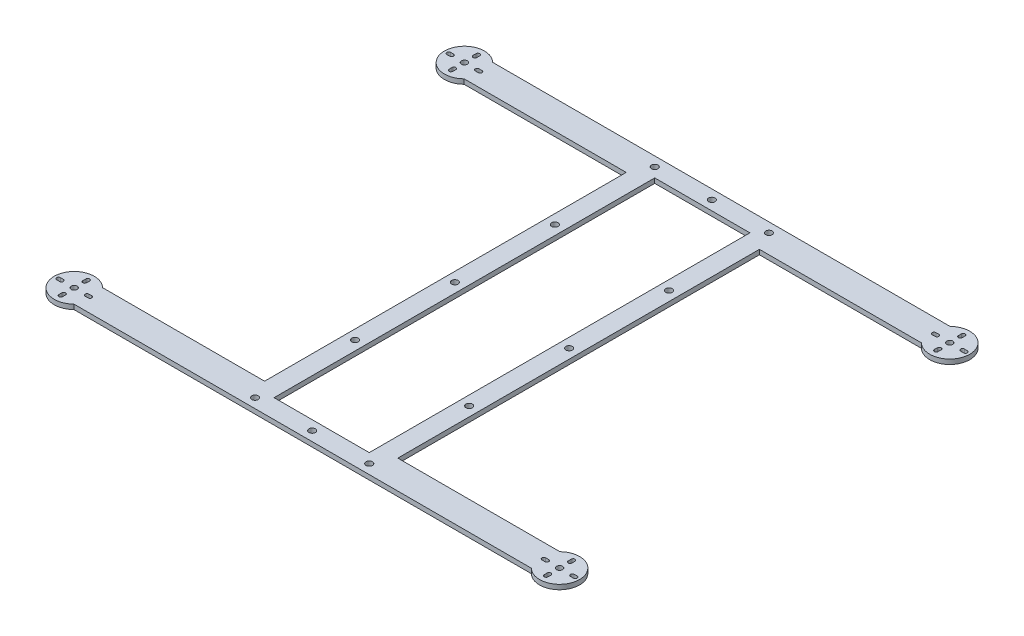
from build123d import *

# Parameters (mm, degrees)
SKETCH1_W           = 63.5
SKETCH1_H           = 254
BOSS_EXTRUDE1_DEPTH = 3.175
SKETCH4_R           = 13.335
BOSS_EXTRUDE4_DEPTH = 3.175
SKETCH5_R           = 2
MOTOR_HOLES_DEPTH   = 227.541979167
SKETCH7_R           = 2.159
CUT_EXTRUDE2_DEPTH  = 227.541979167


with BuildPart() as part:
    # Sketch1 → Boss-Extrude1 (new body)
    with BuildSketch(Plane(origin=(0, 0, 0), x_dir=(1, 0, 0), z_dir=(0, 1, 0))):
        Polygon((-44.45, 139.7), (44.45, 139.7), (161.925, 139.7), (161.925, 120.65), (44.45, 120.65), (44.45, -120.65), (161.925, -120.65), (161.925, -139.7), (44.45, -139.7), (-44.45, -139.7), (-161.925, -139.7), (-161.925, -120.65), (-44.45, -120.65), (-44.45, 120.65), (-161.925, 120.65), (-161.925, 139.7), align=None)
        Rectangle(SKETCH1_W, SKETCH1_H, mode=Mode.SUBTRACT)
    extrude(amount=BOSS_EXTRUDE1_DEPTH)

    # Sketch4 → Boss-Extrude4 (add)
    with BuildSketch(Plane(origin=(0, 3.175, 0), x_dir=(1, 0, 0), z_dir=(0, 1, 0))):
        with Locations((161.925, 130.175)):
            Circle(SKETCH4_R)
        with Locations((-161.925, 130.175)):
            Circle(SKETCH4_R)
        with Locations((-161.925, -130.175)):
            Circle(SKETCH4_R)
        with Locations((161.925, -130.175)):
            Circle(SKETCH4_R)
    extrude(amount=-BOSS_EXTRUDE4_DEPTH)

    # Sketch5 → Motor Holes (cut, through all)
    with BuildSketch(Plane(origin=(0, 3.175, 0), x_dir=(1, 0, 0), z_dir=(0, 1, 0))):
        with Locations(Location((161.925, 130.175, 0), (0, 0, 270))):
            Circle(SKETCH5_R)
        with Locations(Location((-161.925, 130.175, 0), (0, 0, 90))):
            Circle(SKETCH5_R)
        with Locations(Location((161.925, -130.175, 0), (0, 0, 90))):
            Circle(SKETCH5_R)
        with Locations(Location((-161.925, -130.175, 0), (0, 0, 270))):
            Circle(SKETCH5_R)
        with BuildLine():
            Line((151.425, 131.425), (153.425, 131.425))
            ThreePointArc((153.425, 131.425), (154.675, 130.175), (153.425, 128.925))
            Line((153.425, 128.925), (151.425, 128.925))
            ThreePointArc((151.425, 128.925), (150.175, 130.175), (151.425, 131.425))
        make_face()
        with BuildLine():
            Line((172.425, 131.425), (170.425, 131.425))
            ThreePointArc((170.425, 131.425), (169.175, 130.175), (170.425, 128.925))
            Line((170.425, 128.925), (172.425, 128.925))
            ThreePointArc((172.425, 128.925), (173.675, 130.175), (172.425, 131.425))
        make_face()
        with BuildLine():
            Line((163.175, 139.175), (163.175, 137.175))
            ThreePointArc((163.175, 137.175), (161.925, 135.925), (160.675, 137.175))
            Line((160.675, 137.175), (160.675, 139.175))
            ThreePointArc((160.675, 139.175), (161.925, 140.425), (163.175, 139.175))
        make_face()
        with BuildLine():
            Line((163.175, 121.175), (163.175, 123.175))
            ThreePointArc((163.175, 123.175), (161.925, 124.425), (160.675, 123.175))
            Line((160.675, 123.175), (160.675, 121.175))
            ThreePointArc((160.675, 121.175), (161.925, 119.925), (163.175, 121.175))
        make_face()
        with BuildLine():
            Line((-151.425, 131.425), (-153.425, 131.425))
            ThreePointArc((-153.425, 131.425), (-154.675, 130.175), (-153.425, 128.925))
            Line((-153.425, 128.925), (-151.425, 128.925))
            ThreePointArc((-151.425, 128.925), (-150.175, 130.175), (-151.425, 131.425))
        make_face()
        with BuildLine():
            Line((-172.425, 131.425), (-170.425, 131.425))
            ThreePointArc((-170.425, 131.425), (-169.175, 130.175), (-170.425, 128.925))
            Line((-170.425, 128.925), (-172.425, 128.925))
            ThreePointArc((-172.425, 128.925), (-173.675, 130.175), (-172.425, 131.425))
        make_face()
        with BuildLine():
            Line((-163.175, 139.175), (-163.175, 137.175))
            ThreePointArc((-163.175, 137.175), (-161.925, 135.925), (-160.675, 137.175))
            Line((-160.675, 137.175), (-160.675, 139.175))
            ThreePointArc((-160.675, 139.175), (-161.925, 140.425), (-163.175, 139.175))
        make_face()
        with BuildLine():
            Line((-163.175, 121.175), (-163.175, 123.175))
            ThreePointArc((-163.175, 123.175), (-161.925, 124.425), (-160.675, 123.175))
            Line((-160.675, 123.175), (-160.675, 121.175))
            ThreePointArc((-160.675, 121.175), (-161.925, 119.925), (-163.175, 121.175))
        make_face()
        with BuildLine():
            Line((151.425, -131.425), (153.425, -131.425))
            ThreePointArc((153.425, -131.425), (154.675, -130.175), (153.425, -128.925))
            Line((153.425, -128.925), (151.425, -128.925))
            ThreePointArc((151.425, -128.925), (150.175, -130.175), (151.425, -131.425))
        make_face()
        with BuildLine():
            Line((163.175, -139.175), (163.175, -137.175))
            ThreePointArc((163.175, -137.175), (161.925, -135.925), (160.675, -137.175))
            Line((160.675, -137.175), (160.675, -139.175))
            ThreePointArc((160.675, -139.175), (161.925, -140.425), (163.175, -139.175))
        make_face()
        with BuildLine():
            Line((172.425, -131.425), (170.425, -131.425))
            ThreePointArc((170.425, -131.425), (169.175, -130.175), (170.425, -128.925))
            Line((170.425, -128.925), (172.425, -128.925))
            ThreePointArc((172.425, -128.925), (173.675, -130.175), (172.425, -131.425))
        make_face()
        with BuildLine():
            Line((163.175, -121.175), (163.175, -123.175))
            ThreePointArc((163.175, -123.175), (161.925, -124.425), (160.675, -123.175))
            Line((160.675, -123.175), (160.675, -121.175))
            ThreePointArc((160.675, -121.175), (161.925, -119.925), (163.175, -121.175))
        make_face()
        with BuildLine():
            Line((-163.175, -121.175), (-163.175, -123.175))
            ThreePointArc((-163.175, -123.175), (-161.925, -124.425), (-160.675, -123.175))
            Line((-160.675, -123.175), (-160.675, -121.175))
            ThreePointArc((-160.675, -121.175), (-161.925, -119.925), (-163.175, -121.175))
        make_face()
        with BuildLine():
            Line((-163.175, -139.175), (-163.175, -137.175))
            ThreePointArc((-163.175, -137.175), (-161.925, -135.925), (-160.675, -137.175))
            Line((-160.675, -137.175), (-160.675, -139.175))
            ThreePointArc((-160.675, -139.175), (-161.925, -140.425), (-163.175, -139.175))
        make_face()
        with BuildLine():
            Line((-172.425, -131.425), (-170.425, -131.425))
            ThreePointArc((-170.425, -131.425), (-169.175, -130.175), (-170.425, -128.925))
            Line((-170.425, -128.925), (-172.425, -128.925))
            ThreePointArc((-172.425, -128.925), (-173.675, -130.175), (-172.425, -131.425))
        make_face()
        with BuildLine():
            Line((-151.425, -131.425), (-153.425, -131.425))
            ThreePointArc((-153.425, -131.425), (-154.675, -130.175), (-153.425, -128.925))
            Line((-153.425, -128.925), (-151.425, -128.925))
            ThreePointArc((-151.425, -128.925), (-150.175, -130.175), (-151.425, -131.425))
        make_face()
    extrude(amount=-MOTOR_HOLES_DEPTH, mode=Mode.SUBTRACT)

    # Sketch7 → Cut-Extrude2 (cut, through all)
    with BuildSketch(Plane(origin=(0, 3.175, 0), x_dir=(1, 0, 0), z_dir=(0, 1, 0))):
        with Locations(Location((-38.1, 133.35, 0), (0, 0, 270))):
            Circle(SKETCH7_R)
        with Locations(Location((-38.1, 66.675, 0), (0, 0, 270))):
            Circle(SKETCH7_R)
        with Locations(Location((-38.1, 0, 0), (0, 0, 270))):
            Circle(SKETCH7_R)
        with Locations(Location((-38.1, -66.675, 0), (0, 0, 270))):
            Circle(SKETCH7_R)
        with Locations(Location((-38.1, -133.35, 0), (0, 0, 270))):
            Circle(SKETCH7_R)
        with Locations(Location((38.1, -133.35, 0), (0, 0, 90))):
            Circle(SKETCH7_R)
        with Locations(Location((38.1, -66.675, 0), (0, 0, 90))):
            Circle(SKETCH7_R)
        with Locations(Location((38.1, 0, 0), (0, 0, 90))):
            Circle(SKETCH7_R)
        with Locations(Location((38.1, 66.675, 0), (0, 0, 90))):
            Circle(SKETCH7_R)
        with Locations(Location((38.1, 133.35, 0), (0, 0, 90))):
            Circle(SKETCH7_R)
        with Locations(Location((0, 133.35, 0), (0, 0, 270))):
            Circle(SKETCH7_R)
        with Locations(Location((0, -133.35, 0), (0, 0, 90))):
            Circle(SKETCH7_R)
    extrude(amount=-CUT_EXTRUDE2_DEPTH, mode=Mode.SUBTRACT)


solid = part.part
